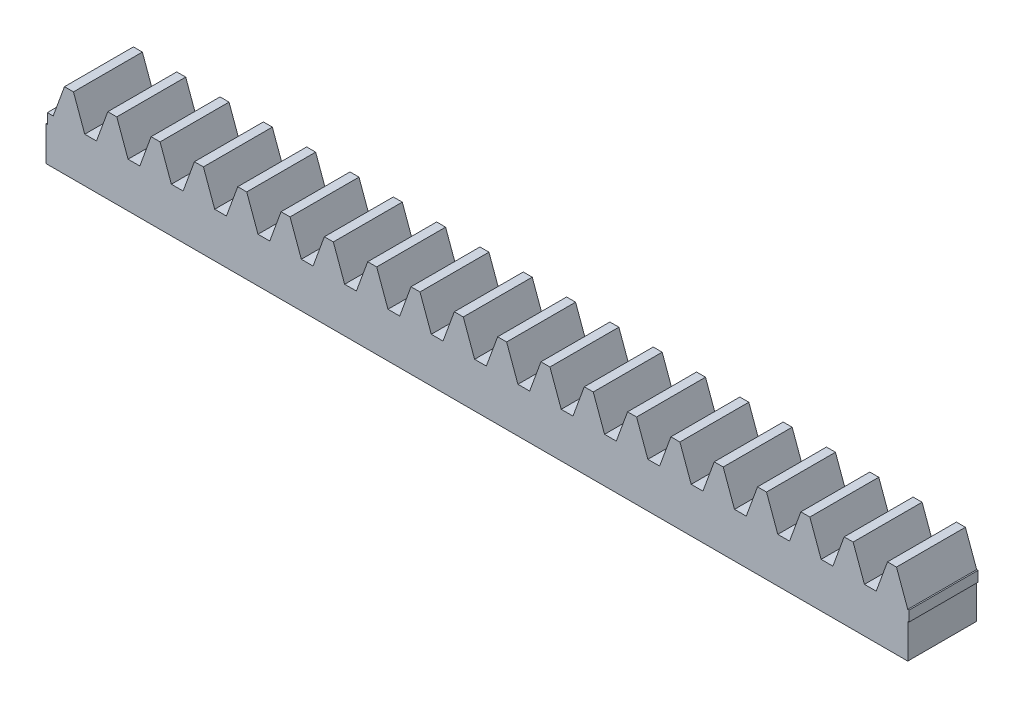
from build123d import *

# Parameters (mm, degrees)
BLANKSKE_W          = 500
BLANKSKE_H          = 24
BLANK_DEPTH         = 40
TOOTHCUTSIM_DEPTH   = 503.171285519
TEETHCUTS_COUNT     = 21
TEETHCUTS_PITCH     = 25.1327412
SKETCH1_W           = 800
SKETCH1_H           = 40
BOSS_EXTRUDE1_DEPTH = 30
SKETCH2_W           = 40
SKETCH2_H           = 30
CUT_EXTRUDE1_DEPTH  = 300
SKETCH3_W           = 500.753658957
SKETCH3_H           = 40
CUT_EXTRUDE3_DEPTH  = 10


with BuildPart() as part:
    # BlankSke → Blank (new body)
    with BuildSketch(Plane.XY):
        with Locations((250, 12)):
            Rectangle(BLANKSKE_W, BLANKSKE_H)
    extrude(amount=-BLANK_DEPTH)

    # TooCutSkeSim → ToothCutSim (cut, through all)
    with BuildSketch(Plane.XY):
        Polygon((3.408482957, 6), (-3.408482957, 6), (-9.969192018, 24.0254), (9.969192018, 24.0254), align=None)
    toothcutsim = extrude(amount=-TOOTHCUTSIM_DEPTH, mode=Mode.SUBTRACT)

    # TeethCuts: ToothCutSim ×21
    with Locations(*[(i * TEETHCUTS_PITCH, 0, 0) for i in range(1, TEETHCUTS_COUNT)]):
        add(toothcutsim, mode=Mode.SUBTRACT)

    # Sketch1 → Boss-Extrude1 (add)
    with BuildSketch(Plane.XZ):
        with Locations((99.246341043, -20)):
            Rectangle(SKETCH1_W, SKETCH1_H)
    extrude(amount=BOSS_EXTRUDE1_DEPTH)

    # Sketch2 → Cut-Extrude1 (cut)
    with BuildSketch(Plane.ZY.offset(300.753658957)):
        with Locations((-20, -15)):
            Rectangle(SKETCH2_W, SKETCH2_H)
    extrude(amount=-CUT_EXTRUDE1_DEPTH, mode=Mode.SUBTRACT)

    # Sketch3 → Cut-Extrude3 (cut)
    with BuildSketch(Plane.XZ.offset(30)):
        with Locations((249.623170522, -20)):
            Rectangle(SKETCH3_W, SKETCH3_H)
    extrude(amount=-CUT_EXTRUDE3_DEPTH, mode=Mode.SUBTRACT)


solid = part.part
